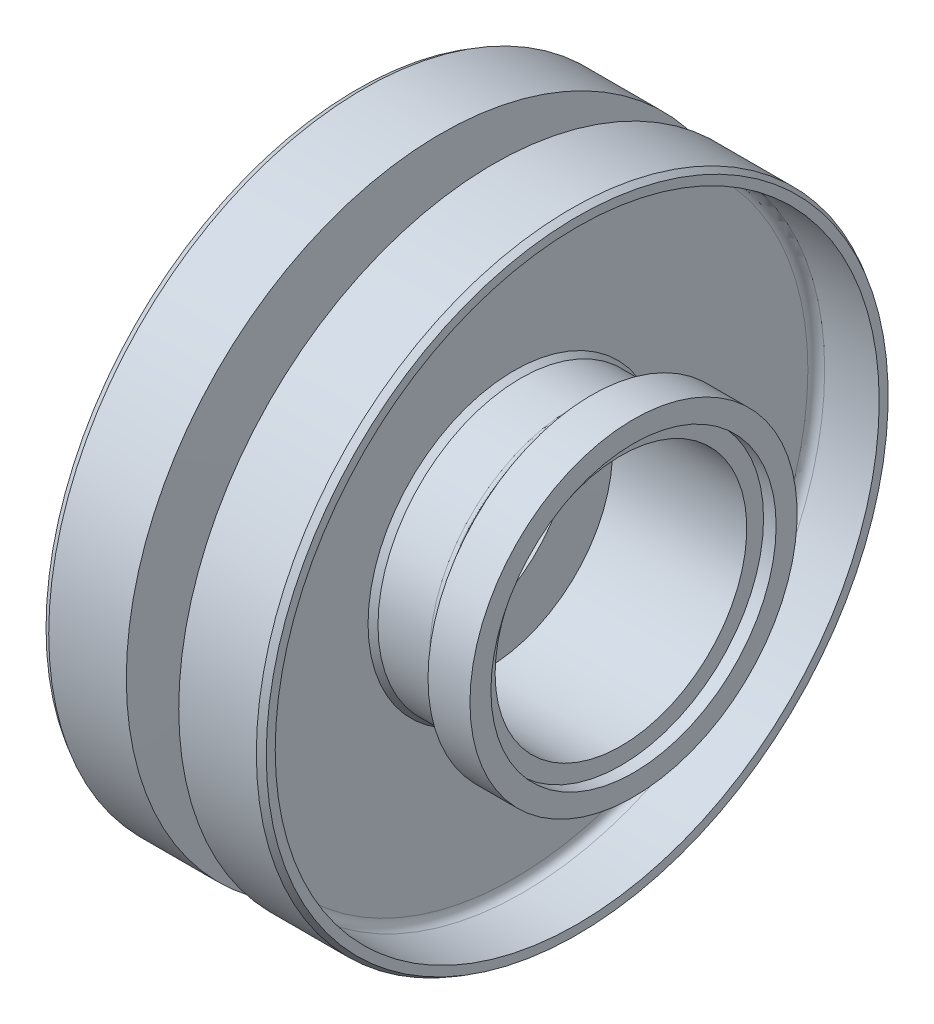
from build123d import *


with BuildPart() as part:
    # Esquisse1 → Révolution1 (revolve)
    with BuildSketch(Plane.XY, mode=Mode.PRIVATE) as r_volution1_sk:
        with BuildLine():
            Line((6.25, 75), (24.75, 75))
            Line((24.75, 75), (26.25, 74.133974596))
            Line((26.25, 74.133974596), (26.25, 72))
            Line((26.25, 72), (13.25, 72))
            ThreePointArc((13.25, 72), (11.835786438, 71.414213562), (11.25, 70))
            Line((11.25, 70), (11.25, 34.866025404))
            Line((11.25, 34.866025404), (12.75, 34))
            Line((12.75, 34), (25.055278677, 34))
            ThreePointArc((25.055278677, 34), (25.967250937, 34.220026237), (26.678565373, 34.831693404))
            Line((26.678565373, 34.831693404), (29.678565373, 39))
            Line((29.678565373, 39), (39.678565373, 39))
            Line((39.678565373, 39), (39.678565373, 34))
            Line((39.678565373, 34), (36.678565373, 34))
            Line((36.678565373, 34), (36.678565373, 30))
            Line((36.678565373, 30), (4.678565373, 30))
            Line((4.678565373, 30), (6.25, 75))
        make_face()
        with BuildLine():
            Line((-11.25, 34.866025404), (-12.75, 34))
            Line((-12.75, 34), (-25.055278677, 34))
            ThreePointArc((-25.055278677, 34), (-25.967250937, 34.220026237), (-26.678565373, 34.831693404))
            Line((-26.678565373, 34.831693404), (-29.678565373, 39))
            Line((-29.678565373, 39), (-39.678565373, 39))
            Line((-39.678565373, 39), (-39.678565373, 34))
            Line((-39.678565373, 34), (-36.678565373, 34))
            Line((-36.678565373, 34), (-36.678565373, 30))
            Line((-36.678565373, 30), (-4.678565373, 30))
            Line((-4.678565373, 30), (-6.25, 75))
            Line((-6.25, 75), (-24.75, 75))
            Line((-24.75, 75), (-26.25, 74.133974596))
            Line((-26.25, 74.133974596), (-26.25, 72))
            Line((-26.25, 72), (-13.25, 72))
            ThreePointArc((-13.25, 72), (-11.835786438, 71.414213562), (-11.25, 70))
            Line((-11.25, 70), (-11.25, 34.866025404))
        make_face()
    revolve(r_volution1_sk.sketch.rotate(Axis((0, 0, 0), (1, 0, 0)), 90), axis=Axis((0, 0, 0), (1, 0, 0)))


solid = part.part
